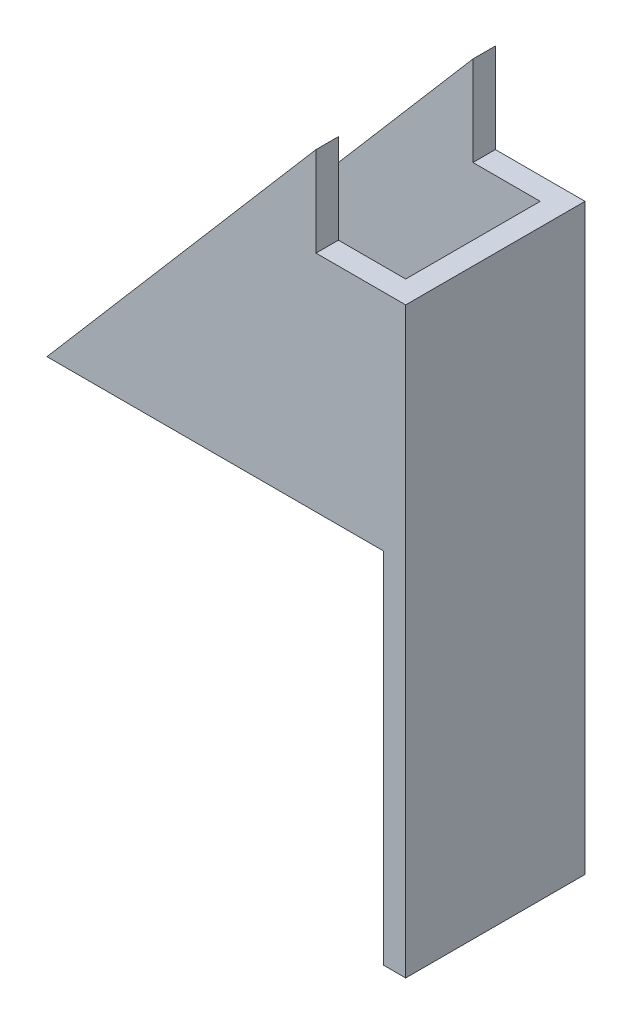
from build123d import *

# Parameters (mm, degrees)
BOSS_EXTRUDE1_DEPTH = 12.7
SKETCH2_W           = 44.45
SKETCH2_H           = 19.05
CUT_EXTRUDE1_DEPTH  = 60.652834174


with BuildPart() as part:
    # Sketch1 → Boss-Extrude1 (new, symmetric)
    with BuildSketch(Plane.XY):
        Polygon((19.05, -50.8), (19.05, 0), (-28.575, 0), (9.525, 44.45), (9.525, 31.75), (22.225, 31.75), (22.225, -50.8), align=None)
    extrude(amount=BOSS_EXTRUDE1_DEPTH, both=True)

    # Sketch2 → Cut-Extrude1 (cut, through all)
    with BuildSketch(Plane.XZ):
        with Locations((-3.175, 0)):
            Rectangle(SKETCH2_W, SKETCH2_H)
    extrude(amount=-CUT_EXTRUDE1_DEPTH, mode=Mode.SUBTRACT)


solid = part.part
